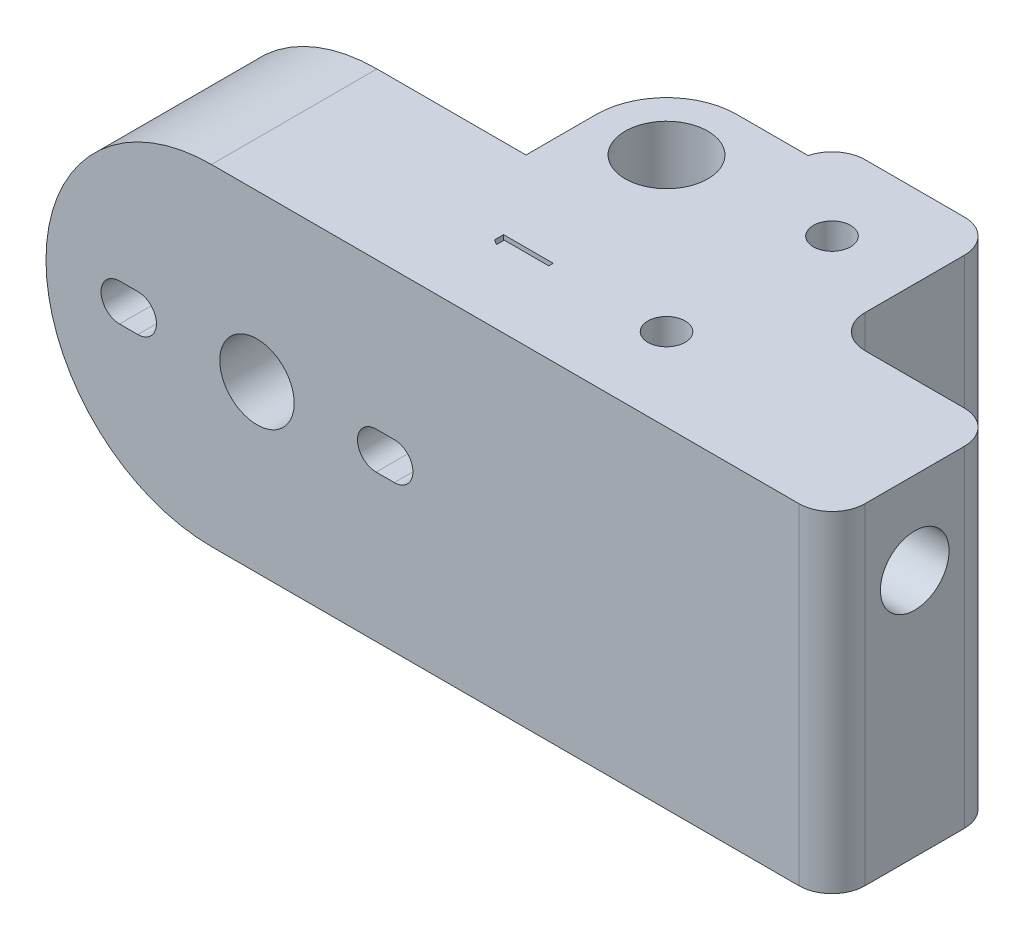
from build123d import *

# Parameters (mm, degrees)
SALIENTE_EXTRUIR1_DEPTH = 40
CROQUIS4_R              = 2.25
CORTAR_EXTRUIR3_DEPTH   = 70.282032303
SALIENTE_EXTRUIR2_DEPTH = 20
CROQUIS8_R              = 4.15
CORTAR_EXTRUIR4_DEPTH   = 25
CROQUIS9_R              = 4.5
CORTAR_EXTRUIR6_DEPTH   = 20
CROQUIS9_4_R            = 4.5
CORTAR_EXTRUIR7_DEPTH   = 5.5
REDONDEO3_R             = 4
CORTAR_EXTRUIR8_DEPTH   = 1
CROQUIS11_R             = 5
SALIENTE_EXTRUIR3_DEPTH = 10


with BuildPart() as part:
    # Croquis1 → Saliente-Extruir1 (new body)
    with BuildSketch(Plane(origin=(0, 0, 0), x_dir=(1, 0, 0), z_dir=(0, 1, 0))):
        Polygon((0, 0), (40, 0), (40, 20), (20, 20), (20, 40), (0, 40), align=None)
    extrude(amount=SALIENTE_EXTRUIR1_DEPTH)

    # Croquis4 → Cortar-Extruir3 (cut, through all)
    with BuildSketch(Plane(origin=(0, 40, 0), x_dir=(1, 0, 0), z_dir=(0, 1, 0))):
        with Locations((10, 30)):
            Circle(CROQUIS4_R)
        with Locations((10, 10)):
            Circle(CROQUIS4_R)
    extrude(amount=-CORTAR_EXTRUIR3_DEPTH, mode=Mode.SUBTRACT)

    # Croquis5 → Saliente-Extruir2 (add)
    with BuildSketch(Plane.XY):
        with BuildLine():
            Line((0, 0), (0, 40))
            Line((0, 40), (-35, 40))
            ThreePointArc((-35, 40), (-55, 20), (-35, 0))
            Line((-35, 0), (0, 0))
        make_face()
    extrude(amount=-SALIENTE_EXTRUIR2_DEPTH)

    # Croquis8 → Cortar-Extruir4 (cut)
    with BuildSketch(Plane(origin=(40, 0, 0), x_dir=(0, 0, -1), z_dir=(1, 0, 0))):
        with Locations((10, 30)):
            Circle(CROQUIS8_R)
    extrude(amount=-CORTAR_EXTRUIR4_DEPTH, mode=Mode.SUBTRACT)

    # Croquis9 → Cortar-Extruir6 (cut)
    with BuildSketch(Plane(origin=(0, 0, -20), x_dir=(-1, 0, 0), z_dir=(0, 0, -1))):
        with Locations((29.5, 20)):
            Circle(CROQUIS9_R)
        with BuildLine():
            Line((12.9, 22.25), (15.1, 22.25))
            ThreePointArc((15.1, 22.25), (17.35, 20), (15.1, 17.75))
            Line((15.1, 17.75), (12.9, 17.75))
            ThreePointArc((12.9, 17.75), (10.65, 20), (12.9, 22.25))
        make_face()
        with BuildLine():
            Line((43.9, 17.75), (46.1, 17.75))
            ThreePointArc((46.1, 17.75), (48.35, 20), (46.1, 22.25))
            Line((46.1, 22.25), (43.9, 22.25))
            ThreePointArc((43.9, 22.25), (41.65, 20), (43.9, 17.75))
        make_face()
    extrude(amount=-CORTAR_EXTRUIR6_DEPTH, mode=Mode.SUBTRACT)

    # Croquis9<4> → Cortar-Extruir7 (cut)
    with BuildSketch(Plane(origin=(0, 0, -20), x_dir=(-1, 0, 0), z_dir=(0, 0, -1))):
        with BuildLine():
            Line((10.978313253, 25.472396189), (25.756024096, 30.661737402))
            ThreePointArc((25.756024096, 30.661737402), (29.5, 31.3), (33.243975904, 30.661737402))
            Line((33.243975904, 30.661737402), (48.021686747, 25.472396189))
            ThreePointArc((48.021686747, 25.472396189), (51.9, 20), (48.021686747, 14.527603811))
            Line((48.021686747, 14.527603811), (33.243975904, 9.338262598))
            ThreePointArc((33.243975904, 9.338262598), (29.5, 8.7), (25.756024096, 9.338262598))
            Line((25.756024096, 9.338262598), (10.978313253, 14.527603811))
            ThreePointArc((10.978313253, 14.527603811), (7.1, 20), (10.978313253, 25.472396189))
        make_face()
        with Locations((29.5, 20)):
            Circle(CROQUIS9_4_R, mode=Mode.SUBTRACT)
        with BuildLine():
            Line((12.9, 22.25), (15.1, 22.25))
            ThreePointArc((15.1, 22.25), (17.35, 20), (15.1, 17.75))
            Line((15.1, 17.75), (12.9, 17.75))
            ThreePointArc((12.9, 17.75), (10.65, 20), (12.9, 22.25))
        make_face(mode=Mode.SUBTRACT)
        with BuildLine():
            Line((43.9, 17.75), (46.1, 17.75))
            ThreePointArc((46.1, 17.75), (48.35, 20), (46.1, 22.25))
            Line((46.1, 22.25), (43.9, 22.25))
            ThreePointArc((43.9, 22.25), (41.65, 20), (43.9, 17.75))
        make_face(mode=Mode.SUBTRACT)
    extrude(amount=-CORTAR_EXTRUIR7_DEPTH, mode=Mode.SUBTRACT)

    # Redondeo3
    redondeo3_edges = [part.edges().sort_by_distance(p)[0] for p in [
        (40, 20, 0),
        (40, 20, -20),
        (20, 20, -20),
        (20, 20, -40),
        (0, 20, -40),
        (0, 20, -20),
    ]]
    fillet(redondeo3_edges, radius=REDONDEO3_R)

    # Croquis10 → Cortar-Extruir8 (cut)
    with BuildSketch(Plane(origin=(0, 40, 0), x_dir=(1, 0, 0), z_dir=(0, 1, 0))):
        Polygon((-10, 9.198317308), (-10, 10.307692308), (-4, 10.307692308), (-4, 9.769230769), (-9.384615385, 9.769230769), (-9.384615385, 8.846153846), align=None)
    extrude(amount=-CORTAR_EXTRUIR8_DEPTH, mode=Mode.SUBTRACT)

    # Croquis11 → Saliente-Extruir3 (add)
    with BuildSketch(Plane(origin=(0, 40, 0), x_dir=(1, 0, 0), z_dir=(0, 1, 0))):
        with BuildLine():
            Line((-16.985046875, 28.492523438), (-16.985046875, 20))
            Line((-16.985046875, 20), (-4, 20))
            ThreePointArc((-4, 20), (-1.171572875, 21.171572875), (0, 24))
            Line((0, 24), (0.123186534, 36.985046875))
            Line((0.123186534, 36.985046875), (-8.492523438, 36.985046875))
            ThreePointArc((-8.492523438, 36.985046875), (-14.49764435, 34.49764435), (-16.985046875, 28.492523438))
        make_face()
        with Locations((-8.492523438, 28.492523438)):
            Circle(CROQUIS11_R, mode=Mode.SUBTRACT)
    extrude(amount=-SALIENTE_EXTRUIR3_DEPTH)


solid = part.part
